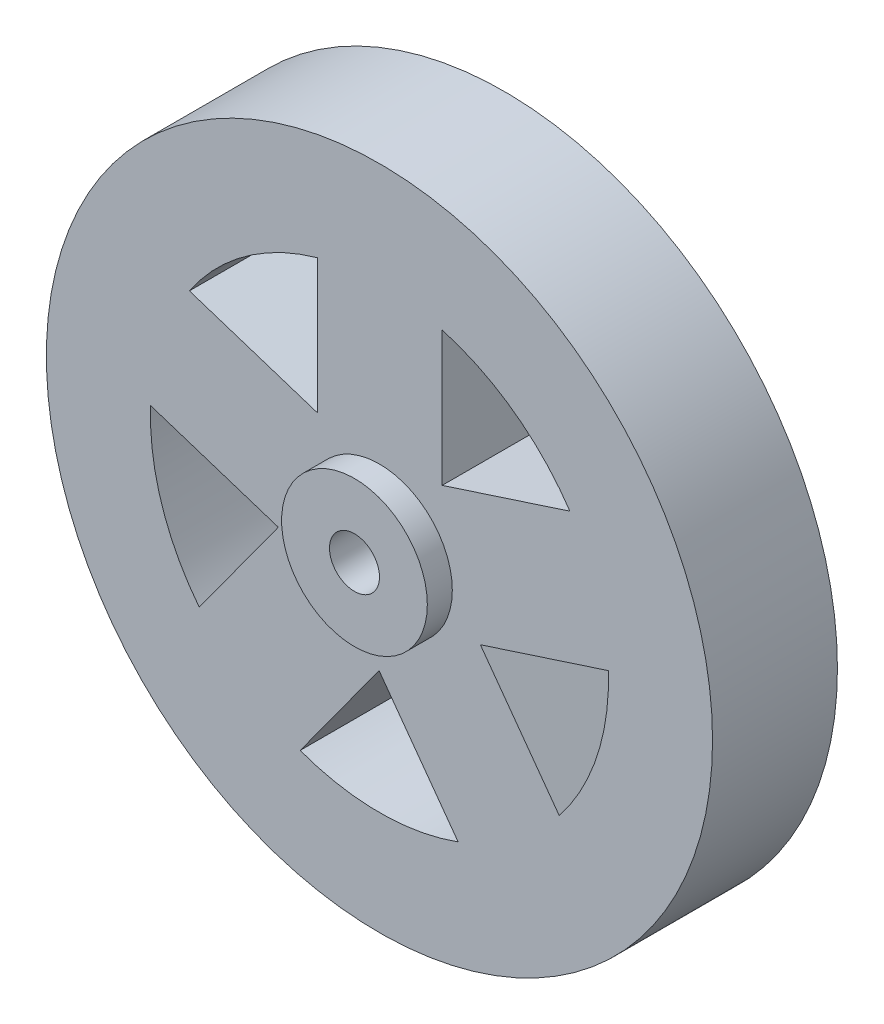
from build123d import *

# Parameters (mm, degrees)
SKETCH1_R                = 40
BOSS_EXTRUDE1_DEPTH      = 15
SKETCH2_R                = 27.5
CUT_EXTRUDE1_DEPTH       = 59.523499554
SKETCH3_R                = 10
BOSS_EXTRUDE3_DEPTH      = 15
BOSS_EXTRUDE4_REACH      = 60.523
BOSS_EXTRUDE4_END_RADIUS = 27.5
SKETCH5_W                = 15
SKETCH5_H                = 15
CIRPATTERN1_COUNT        = 5
SKETCH6_R                = 8.75
BOSS_EXTRUDE5_DEPTH      = 3
SKETCH7_R                = 3
CUT_EXTRUDE2_DEPTH       = 60.363288319


with BuildPart() as part:
    # Sketch1 → Boss-Extrude1 (new body)
    with BuildSketch(Plane.XY):
        Circle(SKETCH1_R)
    extrude(amount=BOSS_EXTRUDE1_DEPTH)

    # Sketch2 → Cut-Extrude1 (cut, through all)
    with BuildSketch(Plane.XY.offset(15)):
        Circle(SKETCH2_R)
    extrude(amount=-CUT_EXTRUDE1_DEPTH, mode=Mode.SUBTRACT)



with BuildPart() as body_2:
    # Sketch3 → Boss-Extrude3 (new body)
    with BuildSketch(Plane.XY):
        Circle(SKETCH3_R)
    extrude(amount=BOSS_EXTRUDE3_DEPTH)


with BuildPart() as part_1:
    add(part.part)

    add(body_2.part)  # Boss-Extrude4 merges body 2
    # Boss-Extrude4: up to this cylinder (the profile starts inside it)
    boss_extrude4_end = Plane(origin=(0, 0, 7.5), z_dir=(0, 0, 1)) * Cylinder(BOSS_EXTRUDE4_END_RADIUS, 177.046, mode=Mode.PRIVATE)
    # Sketch5 → Boss-Extrude4 (add, up to the surface)
    with BuildSketch(Plane(origin=(0, 0, 0), x_dir=(1, 0, 0), z_dir=(0, 1, 0)), mode=Mode.PRIVATE) as boss_extrude4_sk1:
        with Locations((0.0373245, -7.5)):
            Rectangle(SKETCH5_W, SKETCH5_H)
    boss_extrude4_tool1 = extrude(boss_extrude4_sk1.sketch, amount=BOSS_EXTRUDE4_REACH, mode=Mode.PRIVATE) & boss_extrude4_end
    boss_extrude4 = boss_extrude4_tool1.solids().sort_by_distance((0.037325, 0, 7.5))[0]
    add(boss_extrude4)

    # CirPattern1: Boss-Extrude4 ×5 about axis
    cirpattern1_axis = Axis((0, 0, 0), (0, 0, 1))
    for i in range(1, CIRPATTERN1_COUNT):
        add(boss_extrude4.rotate(cirpattern1_axis, i * 360 / CIRPATTERN1_COUNT))

    # Sketch6 → Boss-Extrude5 (add)
    with BuildSketch(Plane.XY.offset(15)):
        Circle(SKETCH6_R)
    extrude(amount=BOSS_EXTRUDE5_DEPTH)

    # Sketch7 → Cut-Extrude2 (cut, through all)
    with BuildSketch(Plane.XY.offset(18)):
        Circle(SKETCH7_R)
    extrude(amount=-CUT_EXTRUDE2_DEPTH, mode=Mode.SUBTRACT)


solid = part_1.part
